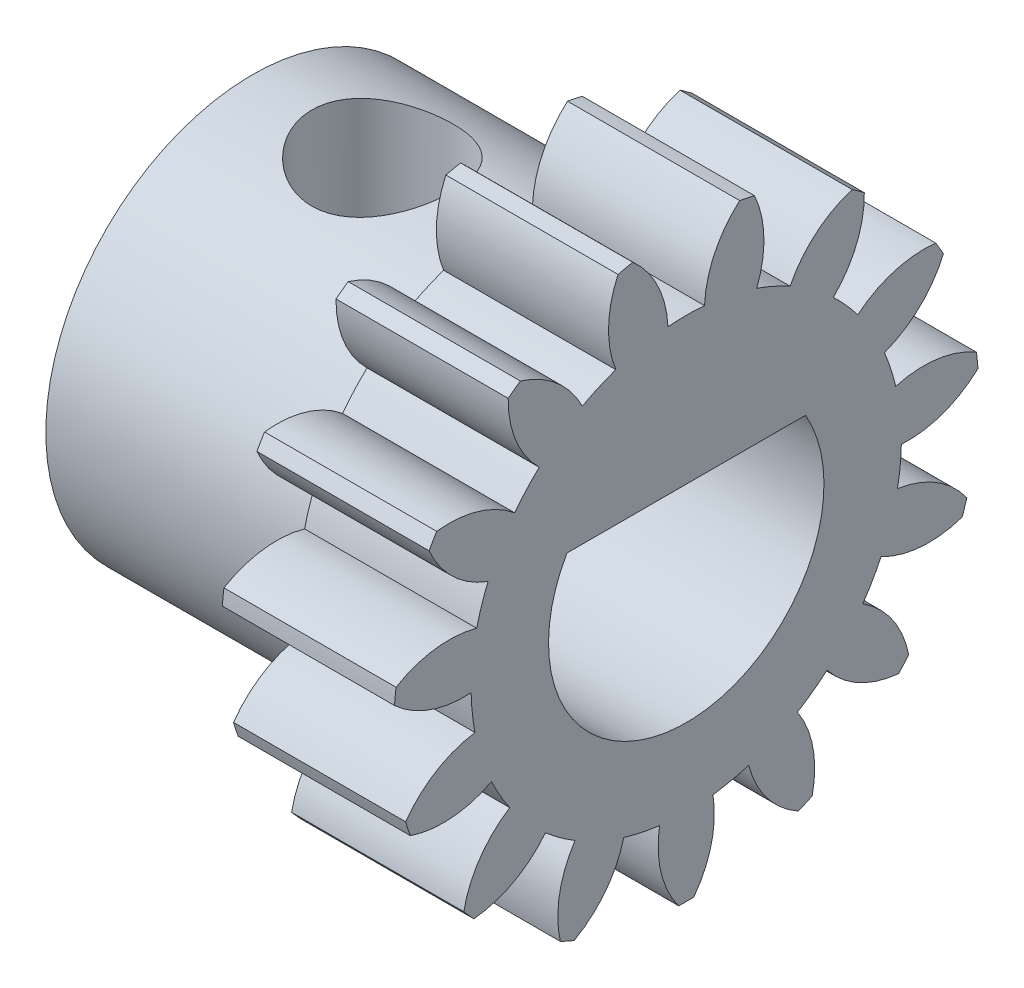
from build123d import *

# Parameters (mm, degrees)
SKETCH1_W                          = 2.5
SKETCH1_H                          = 4.25
CUT_EXTRUDE1_DEPTH                 = 7.509608283
CUT_EXTRUDE2_DEPTH                 = 7.509608283
CUT_EXTRUDE3_DEPTH                 = 7.509608283
CUT_EXTRUDE4_DEPTH                 = 7.509608283
CUT_EXTRUDE5_DEPTH                 = 7.509608283
CUT_EXTRUDE6_DEPTH                 = 7.509608283
CUT_EXTRUDE7_DEPTH                 = 7.509608283
CUT_EXTRUDE8_DEPTH                 = 7.509608283
CUT_EXTRUDE9_DEPTH                 = 7.509608283
CUT_EXTRUDE10_DEPTH                = 7.509608283
CUT_EXTRUDE11_DEPTH                = 7.500982013
CUT_EXTRUDE12_DEPTH                = 7.500982013
CUT_EXTRUDE13_DEPTH                = 7.500982013
CUT_EXTRUDE14_DEPTH                = 7.500982013
CUT_EXTRUDE15_DEPTH                = 7.500982013
SKETCH17_W                         = 3.8000508
SKETCH17_H                         = 3
F_4_0_4_DIAMETER_HOLE1_D           = 4
BOSS_EXTRUDE2_DEPTH                = 6.3000508
TAP_DRILL_FOR_M2_5X0_45_TAP1_D     = 2.05
TAP_DRILL_FOR_M2_5X0_45_TAP1_DEPTH = 3


with BuildPart() as part:
    # Sketch1 → Revolve1 (revolve)
    with BuildSketch(Plane(origin=(0, 0, 0), x_dir=(-1, 0, 0), z_dir=(0, 0, -1)), mode=Mode.PRIVATE) as revolve1_sk:
        with Locations((-1.25, 2.125)):
            Rectangle(SKETCH1_W, SKETCH1_H)
    revolve(revolve1_sk.sketch.rotate(Axis((2.5, 0, 0), (-1, 0, 0)), 270), axis=Axis((2.5, 0, 0), (-1, 0, 0)))

    # Sketch2 → Cut-Extrude1 (cut, through all)
    with BuildSketch(Plane(origin=(2.5, 0, 0), x_dir=(0, 0, -1), z_dir=(1, 0, 0))):
        with BuildLine():
            ThreePointArc((2.585993953, 3.372704445), (2.472774023, 2.780247912), (2.135335156, 2.280289405))
            ThreePointArc((2.135335156, 2.280289405), (2.321584435, 2.090364014), (2.491001044, 1.88528242))
            ThreePointArc((2.491001044, 1.88528242), (3.023492692, 2.168612866), (3.624538392, 2.219283994))
            ThreePointArc((3.624538392, 2.219283994), (3.158365508, 2.843805077), (2.585993953, 3.372704445))
        make_face()
    extrude(amount=-CUT_EXTRUDE1_DEPTH, mode=Mode.SUBTRACT)

    # Sketch3 → Cut-Extrude2 (cut, through all)
    with BuildSketch(Plane(origin=(2.5, 0, 0), x_dir=(0, 0, -1), z_dir=(1, 0, 0))):
        with BuildLine():
            ThreePointArc((3.734225512, 2.029300328), (3.389820178, 1.534115047), (2.87820299, 1.214628975))
            ThreePointArc((2.87820299, 1.214628975), (2.971100557, 0.96536909), (3.042456131, 0.709109787))
            ThreePointArc((3.042456131, 0.709109787), (3.644152332, 0.751361165), (4.213844705, 0.553184234))
            ThreePointArc((4.213844705, 0.553184234), (4.041990194, 1.313322226), (3.734225512, 2.029300328))
        make_face()
    extrude(amount=-CUT_EXTRUDE2_DEPTH, mode=Mode.SUBTRACT)

    # Sketch4 → Cut-Extrude3 (cut, through all)
    with BuildSketch(Plane(origin=(2.5, 0, 0), x_dir=(0, 0, -1), z_dir=(1, 0, 0))):
        with BuildLine():
            ThreePointArc((4.236775558, 0.335011746), (3.72073563, 0.022719752), (3.12340338, -0.061051839))
            ThreePointArc((3.12340338, -0.061051839), (3.106886401, -0.326546919), (3.067842913, -0.589674367))
            ThreePointArc((3.067842913, -0.589674367), (3.634704928, -0.795807707), (4.074538988, -1.208566106))
            ThreePointArc((4.074538988, -1.208566106), (4.226718055, -0.444245969), (4.236775558, 0.335011746))
        make_face()
    extrude(amount=-CUT_EXTRUDE3_DEPTH, mode=Mode.SUBTRACT)

    # Sketch5 → Cut-Extrude4 (cut, through all)
    with BuildSketch(Plane(origin=(2.5, 0, 0), x_dir=(0, 0, -1), z_dir=(1, 0, 0))):
        with BuildLine():
            ThreePointArc((4.00674862, -1.417203408), (3.40830209, -1.492603993), (2.82853895, -1.326176235))
            ThreePointArc((2.82853895, -1.326176235), (2.705463361, -1.562), (2.562771785, -1.786498468))
            ThreePointArc((2.562771785, -1.786498468), (2.996784021, -2.205374197), (3.230708464, -2.761344386))
            ThreePointArc((3.230708464, -2.761344386), (3.680607966, -2.124999999), (4.00674862, -1.417203408))
        make_face()
    extrude(amount=-CUT_EXTRUDE4_DEPTH, mode=Mode.SUBTRACT)

    # Sketch6 → Cut-Extrude5 (cut, through all)
    with BuildSketch(Plane(origin=(2.5, 0, 0), x_dir=(0, 0, -1), z_dir=(1, 0, 0))):
        with BuildLine():
            ThreePointArc((3.083918444, -2.92437122), (2.506542154, -2.749842949), (2.044594439, -2.361992714))
            ThreePointArc((2.044594439, -2.361992714), (1.836241128, -2.52736909), (1.614574134, -2.674420753))
            ThreePointArc((1.614574134, -2.674420753), (1.840691933, -3.233611452), (1.828259097, -3.836661137))
            ThreePointArc((1.828259097, -3.836661137), (2.498087322, -3.438322226), (3.083918444, -2.92437122))
        make_face()
    extrude(amount=-CUT_EXTRUDE5_DEPTH, mode=Mode.SUBTRACT)

    # Sketch7 → Cut-Extrude6 (cut, through all)
    with BuildSketch(Plane(origin=(2.5, 0, 0), x_dir=(0, 0, -1), z_dir=(1, 0, 0))):
        with BuildLine():
            ThreePointArc((1.627850754, -3.925888679), (1.17137831, -3.531609077), (0.907120976, -2.989399193))
            ThreePointArc((0.907120976, -2.989399193), (0.649516122, -3.055733105), (0.387201946, -3.099911394))
            ThreePointArc((0.387201946, -3.099911394), (0.366327487, -3.702727912), (0.109687121, -4.248584321))
            ThreePointArc((0.109687121, -4.248584321), (0.883624686, -4.157127303), (1.627850754, -3.925888679))
        make_face()
    extrude(amount=-CUT_EXTRUDE6_DEPTH, mode=Mode.SUBTRACT)

    # Sketch8 → Cut-Extrude7 (cut, through all)
    with BuildSketch(Plane(origin=(2.5, 0, 0), x_dir=(0, 0, -1), z_dir=(1, 0, 0))):
        with BuildLine():
            ThreePointArc((-0.109687122, -4.248584322), (-0.366327487, -3.702727912), (-0.387201947, -3.099911394))
            ThreePointArc((-0.387201947, -3.099911394), (-0.649516122, -3.055733105), (-0.907120975, -2.989399193))
            ThreePointArc((-0.907120975, -2.989399193), (-1.171378309, -3.531609077), (-1.627850753, -3.92588868))
            ThreePointArc((-1.627850753, -3.92588868), (-0.883624686, -4.157127304), (-0.109687122, -4.248584322))
        make_face()
    extrude(amount=-CUT_EXTRUDE7_DEPTH, mode=Mode.SUBTRACT)

    # Sketch9 → Cut-Extrude8 (cut, through all)
    with BuildSketch(Plane(origin=(2.5, 0, 0), x_dir=(0, 0, -1), z_dir=(1, 0, 0))):
        with BuildLine():
            ThreePointArc((-1.828259096, -3.836661137), (-1.840691932, -3.233611453), (-1.614574133, -2.674420754))
            ThreePointArc((-1.614574133, -2.674420754), (-1.836241128, -2.527369091), (-2.044594439, -2.361992714))
            ThreePointArc((-2.044594439, -2.361992714), (-2.506542155, -2.749842949), (-3.083918444, -2.92437122))
            ThreePointArc((-3.083918444, -2.92437122), (-2.498087322, -3.438322226), (-1.828259096, -3.836661137))
        make_face()
    extrude(amount=-CUT_EXTRUDE8_DEPTH, mode=Mode.SUBTRACT)

    # Sketch10 → Cut-Extrude9 (cut, through all)
    with BuildSketch(Plane(origin=(2.5, 0, 0), x_dir=(0, 0, -1), z_dir=(1, 0, 0))):
        with BuildLine():
            ThreePointArc((-3.230708464, -2.761344387), (-2.996784021, -2.205374197), (-2.562771785, -1.786498468))
            ThreePointArc((-2.562771785, -1.786498468), (-2.705463361, -1.562), (-2.82853895, -1.326176236))
            ThreePointArc((-2.82853895, -1.326176236), (-3.40830209, -1.492603994), (-4.006748619, -1.417203409))
            ThreePointArc((-4.006748619, -1.417203409), (-3.680607966, -2.125), (-3.230708464, -2.761344387))
        make_face()
    extrude(amount=-CUT_EXTRUDE9_DEPTH, mode=Mode.SUBTRACT)

    # Sketch11 → Cut-Extrude10 (cut, through all)
    with BuildSketch(Plane(origin=(2.5, 0, 0), x_dir=(0, 0, -1), z_dir=(1, 0, 0))):
        with BuildLine():
            ThreePointArc((-4.074538989, -1.208566105), (-3.634704928, -0.795807707), (-3.067842914, -0.589674368))
            ThreePointArc((-3.067842914, -0.589674368), (-3.106886402, -0.326546919), (-3.12340338, -0.061051839))
            ThreePointArc((-3.12340338, -0.061051839), (-3.720735631, 0.022719752), (-4.236775558, 0.335011747))
            ThreePointArc((-4.236775558, 0.335011747), (-4.226718056, -0.444245968), (-4.074538989, -1.208566105))
        make_face()
    extrude(amount=-CUT_EXTRUDE10_DEPTH, mode=Mode.SUBTRACT)

    # Sketch12 → Cut-Extrude11 (cut, through all)
    with BuildSketch(Plane(origin=(2.5, 0, 0), x_dir=(0, 0, -1), z_dir=(1, 0, 0))):
        with BuildLine():
            ThreePointArc((-4.213844706, 0.553184234), (-3.644152332, 0.751361165), (-3.042456131, 0.709109788))
            ThreePointArc((-3.042456131, 0.709109788), (-2.971100557, 0.96536909), (-2.87820299, 1.214628975))
            ThreePointArc((-2.87820299, 1.214628975), (-3.389820179, 1.534115046), (-3.734225513, 2.029300326))
            ThreePointArc((-3.734225513, 2.029300326), (-4.041990195, 1.313322226), (-4.213844706, 0.553184234))
        make_face()
    extrude(amount=-CUT_EXTRUDE11_DEPTH, mode=Mode.SUBTRACT)

    # Sketch13 → Cut-Extrude12 (cut, through all)
    with BuildSketch(Plane(origin=(2.5, 0, 0), x_dir=(0, 0, -1), z_dir=(1, 0, 0))):
        with BuildLine():
            ThreePointArc((-2.585993952, 3.372704446), (-3.158365508, 2.843805077), (-3.624538391, 2.219283994))
            ThreePointArc((-3.624538391, 2.219283994), (-3.023492692, 2.168612865), (-2.491001044, 1.885282419))
            ThreePointArc((-2.491001044, 1.885282419), (-2.321584435, 2.090364014), (-2.135335156, 2.280289405))
            ThreePointArc((-2.135335156, 2.280289405), (-2.472774022, 2.780247912), (-2.585993952, 3.372704446))
        make_face()
    extrude(amount=-CUT_EXTRUDE12_DEPTH, mode=Mode.SUBTRACT)

    # Sketch14 → Cut-Extrude13 (cut, through all)
    with BuildSketch(Plane(origin=(2.5, 0, 0), x_dir=(0, 0, -1), z_dir=(1, 0, 0))):
        with BuildLine():
            ThreePointArc((-0.990620545, 4.132937326), (-1.728630733, 3.882568195), (-2.408516462, 3.501649391))
            ThreePointArc((-2.408516462, 3.501649391), (-1.880043697, 3.210891701), (-1.508829246, 2.735472593))
            ThreePointArc((-1.508829246, 2.735472593), (-1.270645273, 2.85391601), (-1.023248474, 2.951667081))
            ThreePointArc((-1.023248474, 2.951667081), (-1.128162774, 3.545650656), (-0.990620545, 4.132937326))
        make_face()
    extrude(amount=-CUT_EXTRUDE13_DEPTH, mode=Mode.SUBTRACT)

    # Sketch15 → Cut-Extrude14 (cut, through all)
    with BuildSketch(Plane(origin=(2.5, 0, 0), x_dir=(0, 0, -1), z_dir=(1, 0, 0))):
        with BuildLine():
            ThreePointArc((-0.776040155, 4.178547795), (-0.411518069, 3.69797819), (-0.265767165, 3.112674704))
            ThreePointArc((-0.265767165, 3.112674704), (0, 3.124), (0.265767165, 3.112674704))
            ThreePointArc((0.265767165, 3.112674704), (0.411518069, 3.69797819), (0.776040156, 4.178547795))
            ThreePointArc((0.776040156, 4.178547795), (0, 4.25), (-0.776040155, 4.178547795))
        make_face()
    extrude(amount=-CUT_EXTRUDE14_DEPTH, mode=Mode.SUBTRACT)

    # Sketch16 → Cut-Extrude15 (cut, through all)
    with BuildSketch(Plane(origin=(2.5, 0, 0), x_dir=(0, 0, -1), z_dir=(1, 0, 0))):
        with BuildLine():
            ThreePointArc((0.990620545, 4.132937326), (1.128162774, 3.545650656), (1.023248474, 2.951667081))
            ThreePointArc((1.023248474, 2.951667081), (1.270645273, 2.85391601), (1.508829246, 2.735472593))
            ThreePointArc((1.508829246, 2.735472593), (1.880043697, 3.210891701), (2.408516462, 3.50164939))
            ThreePointArc((2.408516462, 3.50164939), (1.728630733, 3.882568195), (0.990620545, 4.132937326))
        make_face()
    extrude(amount=-CUT_EXTRUDE15_DEPTH, mode=Mode.SUBTRACT)

    # Sketch17 → Revolve2 (revolve)
    with BuildSketch(Plane.XY, mode=Mode.PRIVATE) as revolve2_sk:
        with Locations((-1.9000254, 1.5)):
            Rectangle(SKETCH17_W, SKETCH17_H)
    revolve(revolve2_sk.sketch.rotate(Axis((-3.8000508, 0, 0), (1, 0, 0)), 270), axis=Axis((-3.8000508, 0, 0), (1, 0, 0)))

    # Ø4.0 (4) Diameter Hole1 (through all)
    with Locations(Plane(origin=(2.5, 0, 0), x_dir=(0, 0, -1), z_dir=(1, 0, 0))):
        with Locations((0, 0)):
            Hole(F_4_0_4_DIAMETER_HOLE1_D / 2)

    # Sketch21 → Boss-Extrude2 (add)
    with BuildSketch(Plane.ZY.offset(3.8000508)):
        with BuildLine():
            Line((-1.732050808, 1), (1.732050808, 1))
            ThreePointArc((1.732050808, 1), (0, 2), (-1.732050808, 1))
        make_face()
    extrude(amount=-BOSS_EXTRUDE2_DEPTH)

    # Tap Drill for M2.5x0.45 Tap1
    with Locations(Plane(origin=(-1.9000508, 2.999970615, 0.013278053), x_dir=(0, -0.004426017667, 0.999990205136), z_dir=(0, 0.999990205136, 0.004426017667))):
        with Locations((0, 0)):
            Hole(TAP_DRILL_FOR_M2_5X0_45_TAP1_D / 2, depth=TAP_DRILL_FOR_M2_5X0_45_TAP1_DEPTH)


solid = part.part
